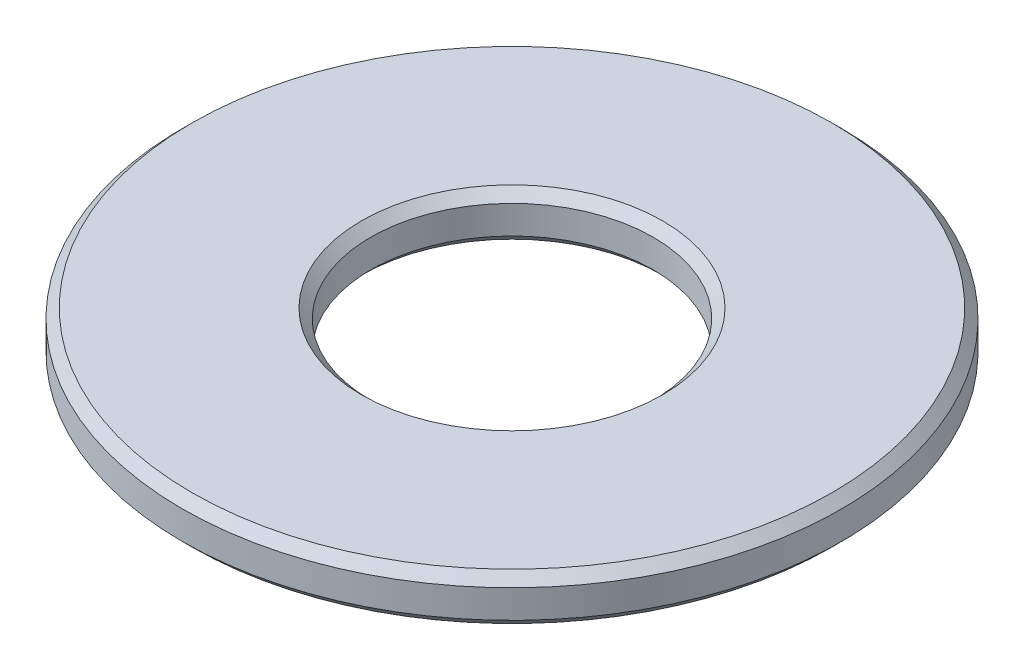
from build123d import *

# Parameters (mm, degrees)
SKETCH1_R           = 7
SKETCH1_R_2         = 3
BOSS_EXTRUDE1_DEPTH = 1
CHAMFER1_SIZE       = 0.2


with BuildPart() as part:
    # Sketch1 → Boss-Extrude1 (new body)
    with BuildSketch(Plane(origin=(0, 0, 0), x_dir=(1, 0, 0), z_dir=(0, 1, 0))):
        with Locations(Location((0, 0, 0), (0, 0, 270))):
            Circle(SKETCH1_R)
        with Locations(Location((0, 0, 0), (0, 0, 270))):
            Circle(SKETCH1_R_2, mode=Mode.SUBTRACT)
    extrude(amount=BOSS_EXTRUDE1_DEPTH)

    # Chamfer1
    chamfer1_edges = [part.edges().sort_by_distance(p)[0] for p in [
        (0, 0, -7),
        (0, 1, -7),
        (0, 0, -3),
        (0, 1, -3),
    ]]
    chamfer(chamfer1_edges, length=CHAMFER1_SIZE)


solid = part.part
